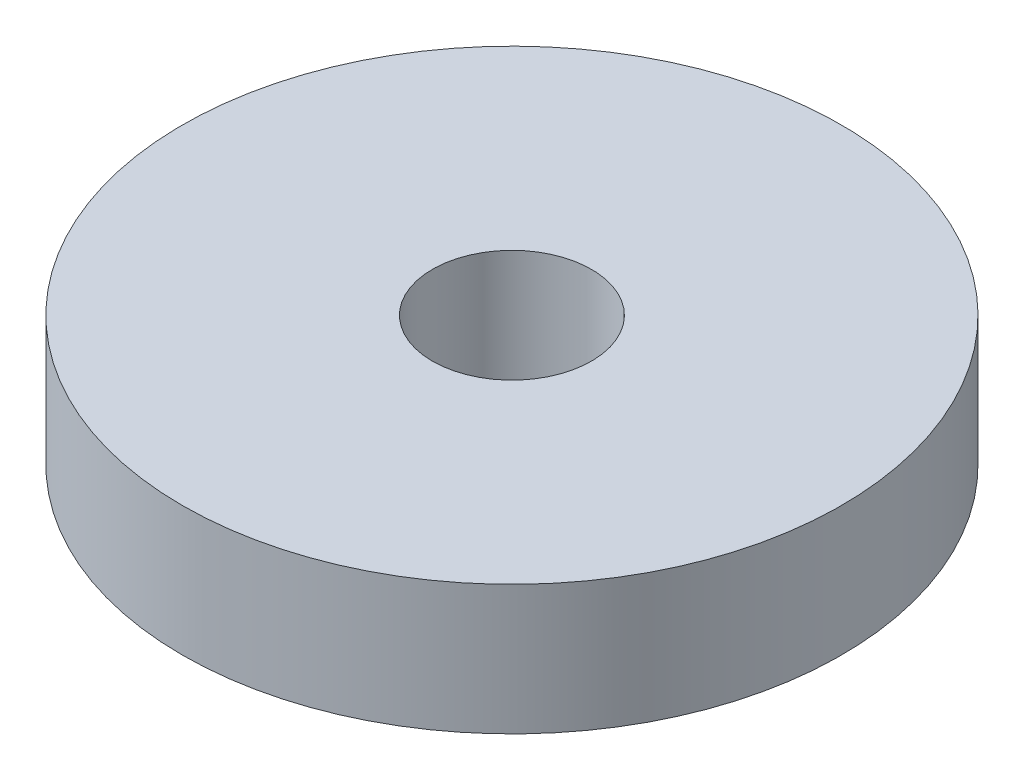
from build123d import *

# Parameters (mm, degrees)
SKETCH1_R           = 7.25
SKETCH1_R_2         = 1.75
BOSS_EXTRUDE1_DEPTH = 2.85


with BuildPart() as part:
    # Sketch1 → Boss-Extrude1 (new body)
    with BuildSketch(Plane(origin=(0, 0, 0), x_dir=(1, 0, 0), z_dir=(0, 1, 0))):
        with Locations(Location((0, 0, 0), (0, 0, 270))):
            Circle(SKETCH1_R)
        with Locations(Location((0, 0, 0), (0, 0, 270))):
            Circle(SKETCH1_R_2, mode=Mode.SUBTRACT)
    extrude(amount=BOSS_EXTRUDE1_DEPTH)


solid = part.part
